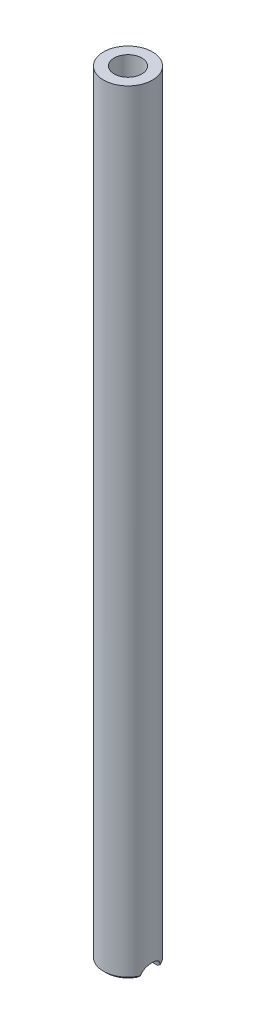
from build123d import *

# Parameters (mm, degrees)
SKETCH1_R               = 3
BOSS_EXTRUDE1_DEPTH     = 95
SKETCH2_R               = 1.7
CUT_EXTRUDE1_DEPTH      = 96.094689652
CHAMFER1_SIZE           = 0.3
CUT_EXTRUDE2_DEPTH      = 96.094689652
CUT_EXTRUDE2_DEPTH_BACK = 96.094689652
SKETCH3_R               = 1.25


with BuildPart() as part:
    # Sketch1 → Boss-Extrude1 (new body)
    with BuildSketch(Plane(origin=(0, 0, 0), x_dir=(1, 0, 0), z_dir=(0, 1, 0))):
        with Locations(Location((0, 0, 0), (0, 0, 270))):
            Circle(SKETCH1_R)
    extrude(amount=BOSS_EXTRUDE1_DEPTH)

    # Sketch2 → Cut-Extrude1 (cut, through all)
    with BuildSketch(Plane(origin=(0, 95, 0), x_dir=(1, 0, 0), z_dir=(0, 1, 0))):
        with Locations(Location((0, 0, 0), (0, 0, 270))):
            Circle(SKETCH2_R)
    extrude(amount=-CUT_EXTRUDE1_DEPTH, mode=Mode.SUBTRACT)

    # Chamfer1
    chamfer1_edges = [part.edges().sort_by_distance(p)[0] for p in [
        (0, 0, -3),
    ]]
    chamfer(chamfer1_edges, length=CHAMFER1_SIZE)

    # Sketch3 → Cut-Extrude2 (cut, two sides: drawn at the far end of the back side and taken through both)
    with BuildSketch(Plane(origin=(0, 0, 0), x_dir=(0, 0, -1), z_dir=(1, 0, 0)).offset(-CUT_EXTRUDE2_DEPTH_BACK)):
        Circle(SKETCH3_R)
    extrude(amount=CUT_EXTRUDE2_DEPTH + CUT_EXTRUDE2_DEPTH_BACK, mode=Mode.SUBTRACT)


solid = part.part
